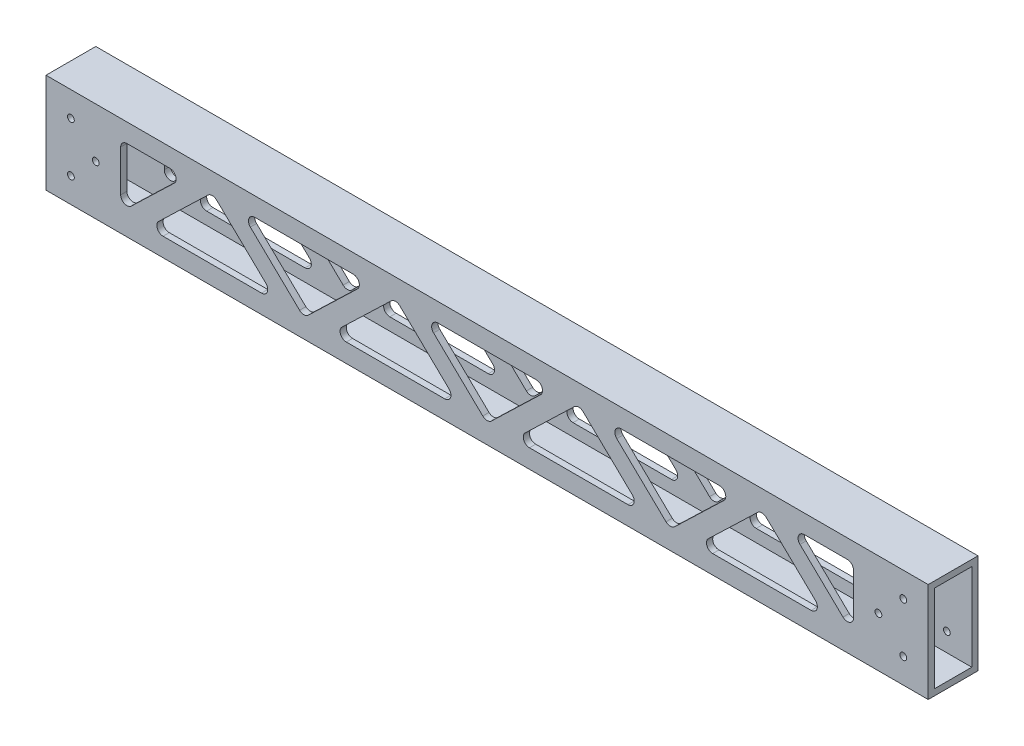
from build123d import *

# Parameters (mm, degrees)
SKETCH1_W             = 25.4
SKETCH1_H             = 50.8
SKETCH1_W_2           = 19.05
SKETCH1_H_2           = 44.45
BOSS_EXTRUDE1_DEPTH   = 225.02495
F_8_32_TAPPED_HOLE1_D = 3.4544
CUT_EXTRUDE1_DEPTH    = 228.873974211
FILLET1_R             = 3.175


with BuildPart() as part:
    # Sketch1 → Boss-Extrude1 (new, symmetric)
    with BuildSketch(Plane(origin=(0, 0, 0), x_dir=(0, 0, -1), z_dir=(1, 0, 0))):
        Rectangle(SKETCH1_W, SKETCH1_H)
        Rectangle(SKETCH1_W_2, SKETCH1_H_2, mode=Mode.SUBTRACT)
    extrude(amount=BOSS_EXTRUDE1_DEPTH, both=True)

    # #8-32 Tapped Hole1 (through all)
    with Locations(Plane.XY.offset(12.7)):
        with Locations((-212.32495, 12.7), (-212.32495, -12.7), (-199.62495, 0), (212.32495, 12.7), (199.62495, 0), (212.32495, -12.7)):
            Hole(F_8_32_TAPPED_HOLE1_D / 2)

    # Sketch4 → Cut-Extrude1 (cut, through all)
    with BuildSketch(Plane.XY.offset(12.7)):
        Polygon((-186.92495, 15.875), (-186.92495, -15.875), (-153.930599661, 15.875), align=None)
        Polygon((-140.1937125, 15.875), (-173.188062839, -15.875), (-107.199362161, -15.875), align=None)
        Polygon((-126.456825339, 15.875), (-93.462475, -15.875), (-60.468124661, 15.875), align=None)
        Polygon((-46.7312375, 15.875), (-79.725587839, -15.875), (-13.736887161, -15.875), align=None)
        Polygon((-32.994350339, 15.875), (0, -15.875), (32.994350339, 15.875), align=None)
        Polygon((13.736887161, -15.875), (46.7312375, 15.875), (79.725587839, -15.875), align=None)
        Polygon((60.468124661, 15.875), (93.462475, -15.875), (126.456825339, 15.875), align=None)
        Polygon((107.199362161, -15.875), (140.1937125, 15.875), (173.188062839, -15.875), align=None)
        Polygon((186.92495, 15.875), (186.92495, -15.875), (153.930599661, 15.875), align=None)
    extrude(amount=-CUT_EXTRUDE1_DEPTH, mode=Mode.SUBTRACT)

    # Fillet1
    fillet1_edges = [part.edges().sort_by_distance(p)[0] for p in [
        (-186.92495, 15.875, -11.1125),
        (-153.930599661, 15.875, -11.1125),
        (-186.92495, -15.875, -11.1125),
        (-186.92495, 15.875, 11.1125),
        (-153.930599661, 15.875, 11.1125),
        (-186.92495, -15.875, 11.1125),
        (-140.1937125, 15.875, -11.1125),
        (-107.199362161, -15.875, -11.1125),
        (-173.188062839, -15.875, -11.1125),
        (-140.1937125, 15.875, 11.1125),
        (-107.199362161, -15.875, 11.1125),
        (-173.188062839, -15.875, 11.1125),
        (-126.456825339, 15.875, -11.1125),
        (-60.468124661, 15.875, -11.1125),
        (-93.462475, -15.875, -11.1125),
        (-126.456825339, 15.875, 11.1125),
        (-60.468124661, 15.875, 11.1125),
        (-93.462475, -15.875, 11.1125),
        (-46.7312375, 15.875, -11.1125),
        (-13.736887161, -15.875, -11.1125),
        (-79.725587839, -15.875, -11.1125),
        (-46.7312375, 15.875, 11.1125),
        (-13.736887161, -15.875, 11.1125),
        (-79.725587839, -15.875, 11.1125),
        (-32.994350339, 15.875, -11.1125),
        (32.994350339, 15.875, -11.1125),
        (0, -15.875, -11.1125),
        (-32.994350339, 15.875, 11.1125),
        (32.994350339, 15.875, 11.1125),
        (0, -15.875, 11.1125),
        (79.725587839, -15.875, -11.1125),
        (13.736887161, -15.875, -11.1125),
        (46.7312375, 15.875, -11.1125),
        (79.725587839, -15.875, 11.1125),
        (13.736887161, -15.875, 11.1125),
        (46.7312375, 15.875, 11.1125),
        (60.468124661, 15.875, -11.1125),
        (126.456825339, 15.875, -11.1125),
        (93.462475, -15.875, -11.1125),
        (60.468124661, 15.875, 11.1125),
        (126.456825339, 15.875, 11.1125),
        (93.462475, -15.875, 11.1125),
        (173.188062839, -15.875, -11.1125),
        (107.199362161, -15.875, -11.1125),
        (140.1937125, 15.875, -11.1125),
        (173.188062839, -15.875, 11.1125),
        (107.199362161, -15.875, 11.1125),
        (140.1937125, 15.875, 11.1125),
        (153.930599661, 15.875, -11.1125),
        (186.92495, 15.875, -11.1125),
        (186.92495, -15.875, -11.1125),
        (153.930599661, 15.875, 11.1125),
        (186.92495, 15.875, 11.1125),
        (186.92495, -15.875, 11.1125),
    ]]
    fillet(fillet1_edges, radius=FILLET1_R)


solid = part.part
